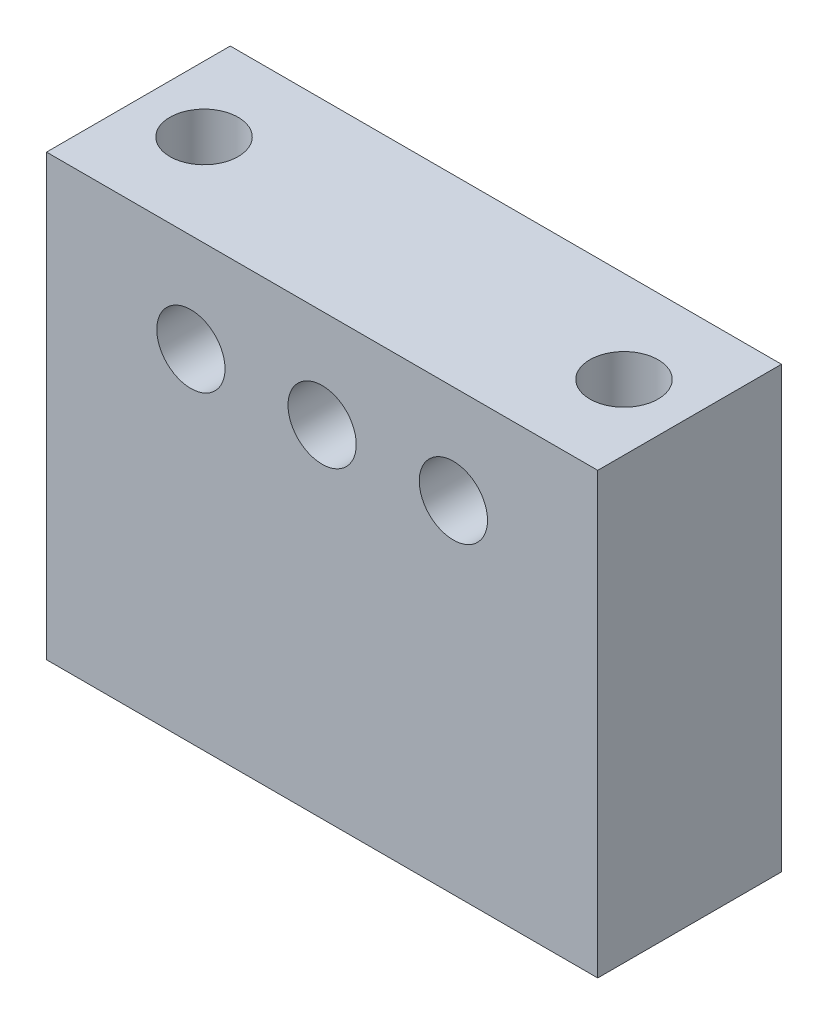
from build123d import *

# Parameters (mm, degrees)
SKETCH3_W           = 42
SKETCH3_H           = 14
BOSS_EXTRUDE2_DEPTH = 33.5
SKETCH4_R           = 2.6
CUT_EXTRUDE2_DEPTH  = 41.152833026
SKETCH5_R           = 2.6
CUT_EXTRUDE3_DEPTH  = 42.943414263


with BuildPart() as part:
    # Sketch3 → Boss-Extrude2 (new body)
    with BuildSketch(Plane(origin=(0, 0, 0), x_dir=(1, 0, 0), z_dir=(0, 1, 0))):
        Rectangle(SKETCH3_W, SKETCH3_H)
    extrude(amount=BOSS_EXTRUDE2_DEPTH)

    # Sketch4 → Cut-Extrude2 (cut, through all)
    with BuildSketch(Plane(origin=(0, 33.5, 0), x_dir=(1, 0, 0), z_dir=(0, 1, 0))):
        with Locations(Location((-16, 0, 0), (0, 0, 270))):
            Circle(SKETCH4_R)
        with Locations(Location((16, 0, 0), (0, 0, 270))):
            Circle(SKETCH4_R)
    extrude(amount=-CUT_EXTRUDE2_DEPTH, mode=Mode.SUBTRACT)

    # Sketch5 → Cut-Extrude3 (cut, through all)
    with BuildSketch(Plane.XY.offset(7)):
        with Locations((0, 26)):
            Circle(SKETCH5_R)
        with Locations((10, 26)):
            Circle(SKETCH5_R)
        with Locations((-10, 26)):
            Circle(SKETCH5_R)
    extrude(amount=-CUT_EXTRUDE3_DEPTH, mode=Mode.SUBTRACT)


solid = part.part
